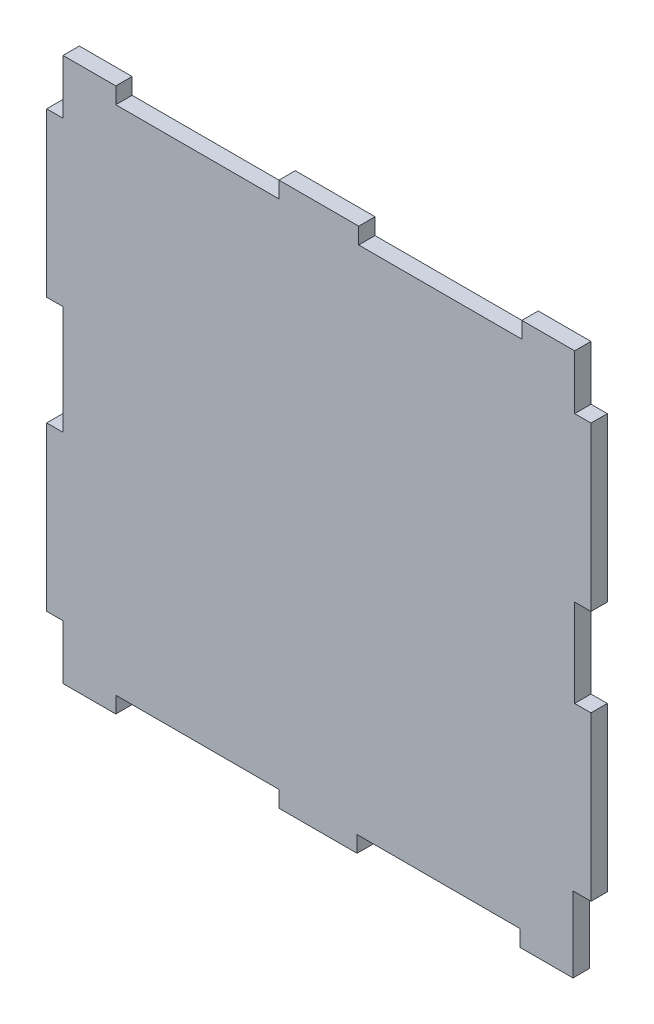
from build123d import *

# Parameters (mm, degrees)
BOSS_EXTRU_1_DEPTH = 3


with BuildPart() as part:
    # Esquisse1 → Boss.-Extru.1 (new body)
    with BuildSketch(Plane.XY):
        Polygon((-57.518120274, -33.413932292), (-57.518120274, -63.413932292), (-54.518120274, -63.413932292), (-54.518120274, -73.413932292), (-44.818120274, -73.413932292), (-44.818120274, -70.413932292), (-14.818120274, -70.413932292), (-14.818120274, -73.413932292), (-0.472510657, -73.413932292), (-0.472510657, -70.413932292), (29.527489343, -70.413932292), (29.527489343, -73.413932292), (39.227489343, -73.413932292), (39.227489343, -59.550988322), (42.535043292, -59.550988322), (42.535043292, -29.550988322), (39.535043292, -29.550988322), (39.535043292, -13.413932292), (42.535043292, -13.413932292), (42.535043292, 16.586067708), (39.535043292, 16.586067708), (39.535043292, 26.586067708), (29.835043292, 26.586067708), (29.835043292, 23.586067708), (-0.164956708, 23.586067708), (-0.164956708, 26.586067708), (-14.818120274, 26.586067708), (-14.818120274, 23.586067708), (-44.818120274, 23.586067708), (-44.818120274, 26.586067708), (-54.518120274, 26.586067708), (-54.518120274, 16.586067708), (-57.518120274, 16.586067708), (-57.518120274, -13.413932292), (-54.518120274, -13.413932292), (-54.518120274, -33.413932292), align=None)
    extrude(amount=BOSS_EXTRU_1_DEPTH)


solid = part.part
